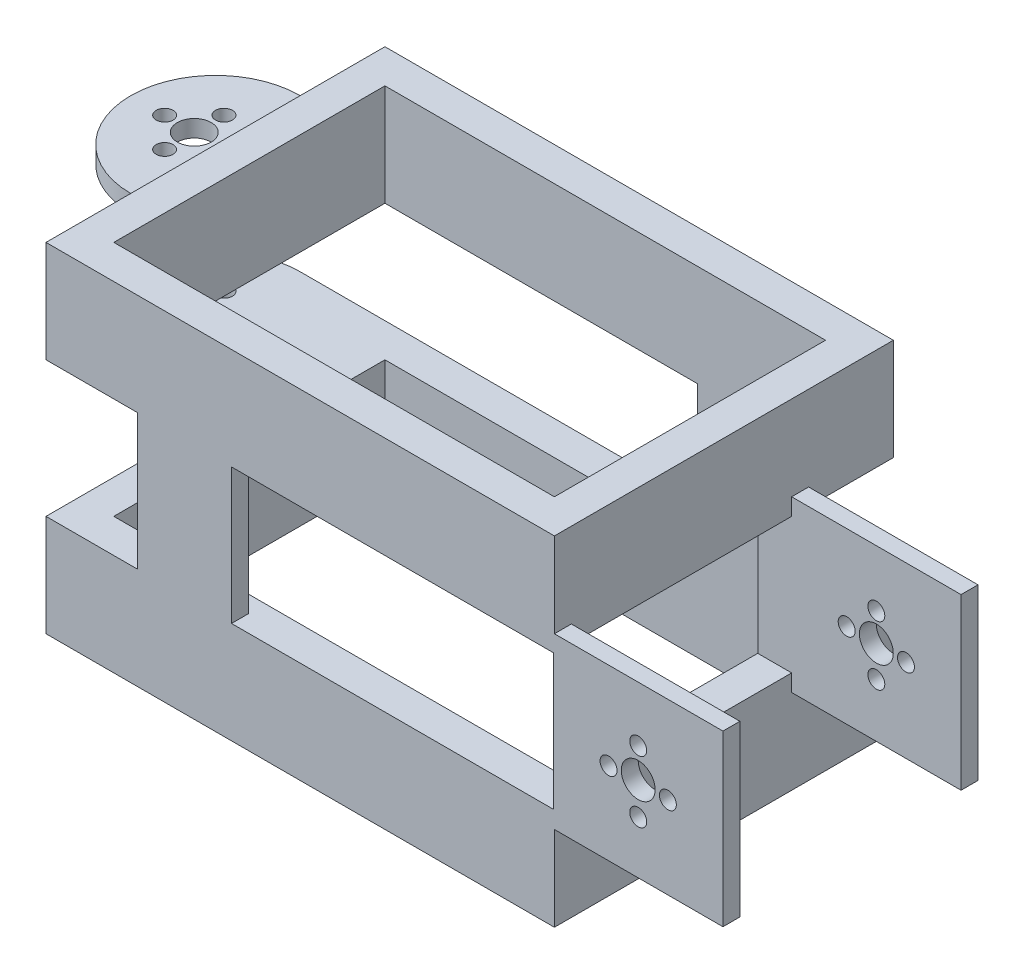
from build123d import *

# Parameters (mm, degrees)
SALIENTE_EXTRUIR1_DEPTH = 40
SKETCH2_R               = 4
SKETCH2_R_2             = 2
CUT_EXTRUDE1_DEPTH      = 50
FILLET3_RADIUS          = 20
FILLET3_LENGTH          = 4
CROQUIS3_W              = 40
CROQUIS3_H              = 40
CROQUIS3_R              = 4
CROQUIS3_R_2            = 2
SALIENTE_EXTRUIR2_DEPTH = 4
SALIENTE_EXTRUIR3_START = -4
SKETCH7_W               = 120
SKETCH7_H               = 80
SALIENTE_EXTRUIR3_DEPTH = 24
CROQUIS4_W              = 40
CROQUIS4_H              = 40
CROQUIS4_R              = 4
CROQUIS4_R_2            = 2
SALIENTE_EXTRUIR4_DEPTH = 4
REDONDEO2_RADIUS        = 20
REDONDEO2_LENGTH        = 4
CROQUIS5_R              = 4
CROQUIS5_R_2            = 2
CORTAR_EXTRUIR1_DEPTH   = 50
CROQUIS6_W              = 22.229294361
CROQUIS6_H              = 60
SALIENTE_EXTRUIR5_DEPTH = 4
CROQUIS8_W              = 104
CROQUIS8_H              = 64
CORTAR_EXTRUIR2_DEPTH   = 80
CROQUIS7_W              = 13.68118259
CROQUIS7_H              = 40
SALIENTE_EXTRUIR6_DEPTH = 4
CROQUIS10_W             = 20.658327355
CROQUIS10_H             = 32
SALIENTE_EXTRUIR7_DEPTH = 8


with BuildPart() as part:
    # Croquis2 → Saliente-Extruir1 (new body)
    with BuildSketch(Plane(origin=(0, 0, 0), x_dir=(0, 1, 0), z_dir=(0, 0, 1))):
        Polygon((-16, -6.258064516), (-16, -4.258064516), (-16, 33.741935484), (-20, 33.741935484), (-20, -6.258064516), align=None)
    saliente_extruir1 = extrude(amount=SALIENTE_EXTRUIR1_DEPTH)

    # Sketch2 → Cut-Extrude1 (cut)
    with BuildSketch(Plane.XZ.offset(20)):
        with Locations(Location((-18.741935484, 20, 0), (0, 0, 270))):
            Circle(SKETCH2_R)
        with Locations(Location((-18.741935484, 27, 0), (0, 0, 270))):
            Circle(SKETCH2_R_2)
        with Locations(Location((-11.741935484, 20, 0), (0, 0, 270))):
            Circle(SKETCH2_R_2)
        with Locations(Location((-18.741935484, 13, 0), (0, 0, 270))):
            Circle(SKETCH2_R_2)
        with Locations(Location((-25.741935484, 20, 0), (0, 0, 270))):
            Circle(SKETCH2_R_2)
    extrude(amount=-CUT_EXTRUDE1_DEPTH, mode=Mode.SUBTRACT)

    # Fillet3: full round fillet: the end face becomes a half cylinder, R = half its width
    fillet3_face = Plane((-33.741935484, -18, 20), x_dir=(0, 1, 0), z_dir=(-1, 0, 0))  # on the end face: x along it, z out of the body
    fillet3_slab = fillet3_face.offset(-FILLET3_RADIUS / 2) * Box(FILLET3_LENGTH, 2 * FILLET3_RADIUS, FILLET3_RADIUS, mode=Mode.PRIVATE)  # the body's end, R deep
    fillet3_round = Plane((-13.741935484, -18, 20), x_dir=(-1, 0, 0), z_dir=(0, 1, 0)) * Cylinder(FILLET3_RADIUS, FILLET3_LENGTH, mode=Mode.PRIVATE)  # its axis R under the face
    add(fillet3_slab - fillet3_round, mode=Mode.SUBTRACT)



with BuildPart() as body_2:
    # Croquis3 → Saliente-Extruir2 (new body)
    with BuildSketch(Plane(origin=(0, 0, 20), x_dir=(0, 1, 0), z_dir=(0, 0, 1))):
        with Locations((0, -146.24009387)):
            Rectangle(CROQUIS3_W, CROQUIS3_H)
        with Locations(Location((0, -146.24009387, 0), (0, 0, 270))):
            Circle(CROQUIS3_R, mode=Mode.SUBTRACT)
        with Locations(Location((0, -139.24009387, 0), (0, 0, 270))):
            Circle(CROQUIS3_R_2, mode=Mode.SUBTRACT)
        with Locations(Location((6.662523083, -146.24009387, 0), (0, 0, 270))):
            Circle(CROQUIS3_R_2, mode=Mode.SUBTRACT)
        with Locations(Location((-0.337476917, -153.24009387, 0), (0, 0, 270))):
            Circle(CROQUIS3_R_2, mode=Mode.SUBTRACT)
        with Locations(Location((-7.337476917, -146.24009387, 0), (0, 0, 270))):
            Circle(CROQUIS3_R_2, mode=Mode.SUBTRACT)
    extrude(amount=SALIENTE_EXTRUIR2_DEPTH)


with BuildPart() as part_1:
    add(part.part)

    add(body_2.part)  # Saliente-Extruir3 merges body 2
    # Sketch7 → Saliente-Extruir3 (add)
    with BuildSketch(Plane.XZ.offset(20).offset(SALIENTE_EXTRUIR3_START)):
        with Locations((66.258064516, 40)):
            Rectangle(SKETCH7_W, SKETCH7_H)
    saliente_extruir3 = extrude(amount=SALIENTE_EXTRUIR3_DEPTH)

    # Croquis4 → Saliente-Extruir4 (add)
    with BuildSketch(Plane.XY.offset(80)):
        with Locations((146.039860125, 0)):
            Rectangle(CROQUIS4_W, CROQUIS4_H)
        with Locations((146.039860125, 0)):
            Circle(CROQUIS4_R, mode=Mode.SUBTRACT)
        with Locations((146.039860125, 7)):
            Circle(CROQUIS4_R_2, mode=Mode.SUBTRACT)
        with Locations((153.039860125, -0.581130473)):
            Circle(CROQUIS4_R_2, mode=Mode.SUBTRACT)
        with Locations((146.039860125, -7.581130473)):
            Circle(CROQUIS4_R_2, mode=Mode.SUBTRACT)
        with Locations((139.039860125, -0.581130473)):
            Circle(CROQUIS4_R_2, mode=Mode.SUBTRACT)
    extrude(amount=-SALIENTE_EXTRUIR4_DEPTH)

    # Simetría3: Saliente-Extruir3 across plane
    add(saliente_extruir3.mirror(Plane.ZX))

    # Simetría4: Saliente-Extruir1 across plane
    add(saliente_extruir1.mirror(Plane.ZX))

    # Redondeo2: full round fillet: the end face becomes a half cylinder, R = half its width
    redondeo2_face = Plane((-33.741935484, 18, 20), x_dir=(0, -1, 0), z_dir=(-1, 0, 0))  # on the end face: x along it, z out of the body
    redondeo2_slab = redondeo2_face.offset(-REDONDEO2_RADIUS / 2) * Box(REDONDEO2_LENGTH, 2 * REDONDEO2_RADIUS, REDONDEO2_RADIUS, mode=Mode.PRIVATE)  # the body's end, R deep
    redondeo2_round = Plane((-13.741935484, 18, 20), x_dir=(-1, 0, 0), z_dir=(0, -1, 0)) * Cylinder(REDONDEO2_RADIUS, REDONDEO2_LENGTH, mode=Mode.PRIVATE)  # its axis R under the face
    add(redondeo2_slab - redondeo2_round, mode=Mode.SUBTRACT)

    # Croquis5 → Cortar-Extruir1 (cut)
    with BuildSketch(Plane(origin=(0, 0, 0), x_dir=(-1, 0, 0), z_dir=(0, 1, 0))):
        with Locations(Location((18.741935484, 20, 0), (0, 0, 270))):
            Circle(CROQUIS5_R)
        with Locations(Location((18.741935484, 27, 0), (0, 0, 270))):
            Circle(CROQUIS5_R_2)
        with Locations(Location((25.741935484, 20, 0), (0, 0, 270))):
            Circle(CROQUIS5_R_2)
        with Locations(Location((18.741935484, 13, 0), (0, 0, 270))):
            Circle(CROQUIS5_R_2)
        with Locations(Location((11.741935484, 20, 0), (0, 0, 270))):
            Circle(CROQUIS5_R_2)
    extrude(amount=CORTAR_EXTRUIR1_DEPTH, mode=Mode.SUBTRACT)

    # Croquis6 → Saliente-Extruir5 (add)
    with BuildSketch(Plane.XY.offset(80)):
        with Locations((38.92855935, -10)):
            Rectangle(CROQUIS6_W, CROQUIS6_H)
    extrude(amount=-SALIENTE_EXTRUIR5_DEPTH)

    # Croquis8 → Cortar-Extruir2 (cut)
    with BuildSketch(Plane.XZ.offset(40)):
        with Locations((66.258064516, 40)):
            Rectangle(CROQUIS8_W, CROQUIS8_H)
    extrude(amount=-CORTAR_EXTRUIR2_DEPTH, mode=Mode.SUBTRACT)

    # Croquis7 → Saliente-Extruir6 (add)
    with BuildSketch(Plane(origin=(0, 0, 20), x_dir=(1, 0, 0), z_dir=(0, 0, -1))):
        with Locations((125.098655811, 0)):
            Rectangle(CROQUIS7_W, CROQUIS7_H)
    extrude(amount=-SALIENTE_EXTRUIR6_DEPTH)

    # Croquis10 → Saliente-Extruir7 (add)
    with BuildSketch(Plane.XY.offset(8)):
        with Locations((98.370697006, 0)):
            Rectangle(CROQUIS10_W, CROQUIS10_H)
    extrude(amount=-SALIENTE_EXTRUIR7_DEPTH)


solid = part_1.part
